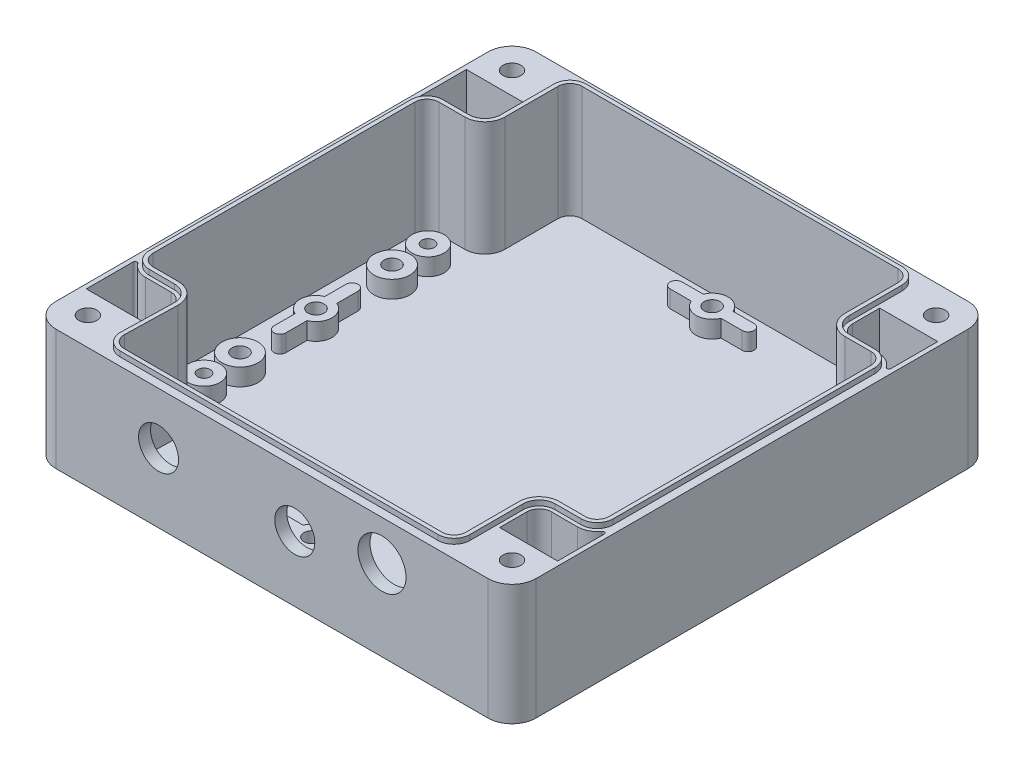
from build123d import *

# Parameters (mm, degrees)
SKETCH_1_R             = 2.25
EXTRUDE_1_DEPTH        = 31.5
CUT_EXTRUDE_1_DEPTH    = 28.65
CUT_EXTRUDE_START      = -1.3
CUT_EXTRUDE_2_DEPTH    = 1.3
SKETCH_4_R             = 4.5
SKETCH_4_R_2           = 2
SKETCH_4_R_3           = 4
EXTRUDE_5_DEPTH        = 4.3
HOLE_WIZARD_M3_1_D     = 3.15
HOLE_WIZARD_M3_1_DEPTH = 4
HOLE_WIZARD_M3_1_TIP   = 0.946355475
CUT_EXTRUDE_3_REACH    = 174.842
SKETCH_7_R             = 5
SKETCH_7_R_2           = 6


with BuildPart() as part:
    # 草圖1 → 填料-伸長1 (new body)
    with BuildSketch(Plane(origin=(0, 0, 0), x_dir=(1, 0, 0), z_dir=(0, 1, 0))):
        with BuildLine():
            Line((6.340909091, 120.340909091), (114.340909091, 120.340909091))
            ThreePointArc((114.340909091, 120.340909091), (118.583549778, 118.583549778), (120.340909091, 114.340909091))
            Line((120.340909091, 114.340909091), (120.340909091, 6.340909091))
            ThreePointArc((120.340909091, 6.340909091), (118.583549778, 2.098268404), (114.340909091, 0.340909091))
            Line((114.340909091, 0.340909091), (6.340909091, 0.340909091))
            ThreePointArc((6.340909091, 0.340909091), (2.098268404, 2.098268404), (0.340909091, 6.340909091))
            Line((0.340909091, 6.340909091), (0.340909091, 114.340909091))
            ThreePointArc((0.340909091, 114.340909091), (2.098268404, 118.583549778), (6.340909091, 120.340909091))
        make_face()
        with Locations(Location((7.340909091, 113.340909091, 0), (0, 0, 270))):
            Circle(SKETCH_1_R, mode=Mode.SUBTRACT)
        with Locations(Location((7.340909091, 103.340909091, 0), (0, 0, 270))):
            Circle(SKETCH_1_R, mode=Mode.SUBTRACT)
        with Locations(Location((113.340909091, 113.340909091, 0), (0, 0, 270))):
            Circle(SKETCH_1_R, mode=Mode.SUBTRACT)
        with Locations(Location((113.340909091, 103.340909091, 0), (0, 0, 270))):
            Circle(SKETCH_1_R, mode=Mode.SUBTRACT)
        with Locations(Location((7.340909091, 17.340909091, 0), (0, 0, 270))):
            Circle(SKETCH_1_R, mode=Mode.SUBTRACT)
        with Locations(Location((7.340909091, 7.340909091, 0), (0, 0, 270))):
            Circle(SKETCH_1_R, mode=Mode.SUBTRACT)
        with Locations(Location((113.340909091, 17.340909091, 0), (0, 0, 270))):
            Circle(SKETCH_1_R, mode=Mode.SUBTRACT)
        with Locations(Location((113.340909091, 7.340909091, 0), (0, 0, 270))):
            Circle(SKETCH_1_R, mode=Mode.SUBTRACT)
    extrude(amount=EXTRUDE_1_DEPTH)

    # 草圖2 → 除料-伸長1 (cut)
    with BuildSketch(Plane(origin=(0, 31.5, 0), x_dir=(1, 0, 0), z_dir=(0, 1, 0))):
        with BuildLine():
            Line((15.940908992, 101.053812481), (15.940908992, 107.840909091))
            Line((15.940908992, 107.840909091), (1.440909091, 107.840909091))
            Line((1.440909091, 107.840909091), (1.440909091, 96.184307649))
            ThreePointArc((1.440909091, 96.184307649), (1.788763936, 95.708017977), (2.348316498, 95.894446985))
            ThreePointArc((2.348316498, 95.894446985), (4.094702185, 97.408643653), (6.340909091, 97.953812481))
            Line((6.340909091, 97.953812481), (12.840908992, 97.953812481))
            ThreePointArc((12.840908992, 97.953812481), (15.032940014, 98.861781459), (15.940908992, 101.053812481))
        make_face()
        with BuildLine():
            Line((6.328095563, 22.75810538), (12.727920948, 22.741369743))
            ThreePointArc((12.727920948, 22.741369743), (14.940810853, 21.804058056), (15.818922369, 19.567016463))
            Line((15.818922369, 19.567016463), (15.65752772, 12.840909091))
            Line((15.65752772, 12.840909091), (1.440909091, 12.840909091))
            Line((1.440909091, 12.840909091), (1.440909091, 24.527593458))
            ThreePointArc((1.440909091, 24.527593458), (1.788763936, 25.00388313), (2.348316498, 24.817454121))
            ThreePointArc((2.348316498, 24.817454121), (4.089010146, 23.306198101), (6.328095563, 22.75810538))
        make_face()
        with BuildLine():
            Line((6.340909091, 96.053812481), (12.840908992, 96.053812481))
            ThreePointArc((12.840908992, 96.053812481), (16.376442898, 97.518278575), (17.840908992, 101.053812481))
            Line((17.840908992, 101.053812481), (17.840908992, 114.340909091))
            ThreePointArc((17.840908992, 114.340909091), (18.719588648, 116.462229434), (20.840908992, 117.340909091))
            Line((20.840908992, 117.340909091), (99.84090919, 117.340909091))
            ThreePointArc((99.84090919, 117.340909091), (101.962229533, 116.462229434), (102.84090919, 114.340909091))
            Line((102.84090919, 114.340909091), (102.84090919, 101.053812481))
            ThreePointArc((102.84090919, 101.053812481), (104.305375284, 97.518278575), (107.84090919, 96.053812481))
            Line((107.84090919, 96.053812481), (114.340909091, 96.053812481))
            ThreePointArc((114.340909091, 96.053812481), (116.462229434, 95.175132824), (117.340909091, 93.053812481))
            Line((117.340909091, 93.053812481), (117.340909091, 27.628005701))
            ThreePointArc((117.340909091, 27.628005701), (116.462229434, 25.506685358), (114.340909091, 24.628005701))
            Line((114.340909091, 24.628005701), (107.84090919, 24.628005701))
            ThreePointArc((107.84090919, 24.628005701), (104.305375284, 23.163539607), (102.84090919, 19.628005701))
            Line((102.84090919, 19.628005701), (102.84090919, 6.340909091))
            ThreePointArc((102.84090919, 6.340909091), (101.962229533, 4.219588747), (99.84090919, 3.340909091))
            Line((99.84090919, 3.340909091), (20.402969013, 3.340909091))
            ThreePointArc((20.402969013, 3.340909091), (18.256355968, 4.245186678), (17.403832299, 6.412874136))
            Line((17.403832299, 6.412874136), (17.718375622, 19.521438601))
            ThreePointArc((17.718375622, 19.521438601), (16.302066724, 23.129570204), (12.732889459, 24.641363247))
            Line((12.732889459, 24.641363247), (6.333064074, 24.658098883))
            ThreePointArc((6.333064074, 24.658098883), (4.216816926, 25.53954373), (3.340909091, 27.658088626))
            Line((3.340909091, 27.658088626), (3.340909091, 93.053812481))
            ThreePointArc((3.340909091, 93.053812481), (4.219588747, 95.175132824), (6.340909091, 96.053812481))
        make_face()
        with BuildLine():
            Line((104.74090919, 19.628005701), (104.74090919, 12.840909091))
            Line((104.74090919, 12.840909091), (119.240909091, 12.840909091))
            Line((119.240909091, 12.840909091), (119.240909091, 24.497510533))
            ThreePointArc((119.240909091, 24.497510533), (118.893054246, 24.973800205), (118.333501683, 24.787371196))
            ThreePointArc((118.333501683, 24.787371196), (116.587115997, 23.273174529), (114.340909091, 22.728005701))
            Line((114.340909091, 22.728005701), (107.84090919, 22.728005701))
            ThreePointArc((107.84090919, 22.728005701), (105.648878168, 21.820036723), (104.74090919, 19.628005701))
        make_face()
        with BuildLine():
            Line((114.340909091, 97.953812481), (107.84090919, 97.953812481))
            ThreePointArc((107.84090919, 97.953812481), (105.648878168, 98.861781459), (104.74090919, 101.053812481))
            Line((104.74090919, 101.053812481), (104.74090919, 107.840909091))
            Line((104.74090919, 107.840909091), (119.240909091, 107.840909091))
            Line((119.240909091, 107.840909091), (119.240909091, 96.184307649))
            ThreePointArc((119.240909091, 96.184307649), (118.893054246, 95.708017977), (118.333501683, 95.894446985))
            ThreePointArc((118.333501683, 95.894446985), (116.587115997, 97.408643653), (114.340909091, 97.953812481))
        make_face()
    extrude(amount=-CUT_EXTRUDE_1_DEPTH, mode=Mode.SUBTRACT)

    # 草圖3 → 除料-伸長2 (cut)
    with BuildSketch(Plane(origin=(0, 31.5, 0), x_dir=(1, 0, 0), z_dir=(0, 1, 0)).offset(CUT_EXTRUDE_START)):
        with BuildLine():
            Line((6.340909091, 0.340909091), (114.340909091, 0.340909091))
            ThreePointArc((114.340909091, 0.340909091), (118.583549778, 2.098268404), (120.340909091, 6.340909091))
            Line((120.340909091, 6.340909091), (120.340909091, 114.340909091))
            ThreePointArc((120.340909091, 114.340909091), (118.583549778, 118.583549778), (114.340909091, 120.340909091))
            Line((114.340909091, 120.340909091), (6.340909091, 120.340909091))
            ThreePointArc((6.340909091, 120.340909091), (2.098268404, 118.583549778), (0.340909091, 114.340909091))
            Line((0.340909091, 114.340909091), (0.340909091, 6.340909091))
            ThreePointArc((0.340909091, 6.340909091), (2.098268404, 2.098268404), (6.340909091, 0.340909091))
        make_face()
        with BuildLine():
            Line((103.84090919, 101.053812481), (103.84090919, 114.340909091))
            ThreePointArc((103.84090919, 114.340909091), (102.669336315, 117.169336216), (99.84090919, 118.340909091))
            Line((99.84090919, 118.340909091), (20.840908992, 118.340909091))
            ThreePointArc((20.840908992, 118.340909091), (18.012481867, 117.169336216), (16.840908992, 114.340909091))
            Line((16.840908992, 114.340909091), (16.840908992, 101.053812481))
            ThreePointArc((16.840908992, 101.053812481), (15.669336117, 98.225385356), (12.840908992, 97.053812481))
            Line((12.840908992, 97.053812481), (6.340909091, 97.053812481))
            ThreePointArc((6.340909091, 97.053812481), (3.512481966, 95.882239605), (2.340909091, 93.053812481))
            Line((2.340909091, 93.053812481), (2.340909091, 27.658088626))
            ThreePointArc((2.340909091, 27.658088626), (3.508786204, 24.833362099), (6.330449068, 23.658102303))
            Line((6.330449068, 23.658102303), (12.730274453, 23.641366666))
            ThreePointArc((12.730274453, 23.641366666), (15.585616265, 22.431932231), (16.718663383, 19.545426949))
            Line((16.718663383, 19.545426949), (16.40412006, 6.436862484))
            ThreePointArc((16.40412006, 6.436862484), (17.540818286, 3.54661254), (20.402969013, 2.340909091))
            Line((20.402969013, 2.340909091), (99.84090919, 2.340909091))
            ThreePointArc((99.84090919, 2.340909091), (102.669336315, 3.512481966), (103.84090919, 6.340909091))
            Line((103.84090919, 6.340909091), (103.84090919, 19.628005701))
            ThreePointArc((103.84090919, 19.628005701), (105.012482065, 22.456432826), (107.84090919, 23.628005701))
            Line((107.84090919, 23.628005701), (114.340909091, 23.628005701))
            ThreePointArc((114.340909091, 23.628005701), (117.169336216, 24.799578576), (118.340909091, 27.628005701))
            Line((118.340909091, 27.628005701), (118.340909091, 93.053812481))
            ThreePointArc((118.340909091, 93.053812481), (117.169336216, 95.882239605), (114.340909091, 97.053812481))
            Line((114.340909091, 97.053812481), (107.84090919, 97.053812481))
            ThreePointArc((107.84090919, 97.053812481), (105.012482065, 98.225385356), (103.84090919, 101.053812481))
        make_face(mode=Mode.SUBTRACT)
    extrude(amount=CUT_EXTRUDE_2_DEPTH, mode=Mode.SUBTRACT)

    # 草圖4 → 填料-伸長5 (add)
    # profile 1 of 12: a face of its own
    with BuildSketch(Plane(origin=(0, 2.85, 0), x_dir=(1, 0, 0), z_dir=(0, 1, 0))):
        with Locations(Location((11.340909091, 79.355950553, 0), (0, 0, 90))):
            Circle(SKETCH_4_R)
        with Locations(Location((11.340909091, 79.355950553, 0), (0, 0, 90))):
            Circle(SKETCH_4_R_2, mode=Mode.SUBTRACT)
    # profile 2 of 12: a face of its own
    with BuildSketch(Plane(origin=(0, 2.85, 0), x_dir=(1, 0, 0), z_dir=(0, 1, 0))):
        with Locations(Location((11.340909091, 88.355950553, 0), (0, 0, 90))):
            Circle(SKETCH_4_R_3)
    # profile 3 of 12: a face of its own
    with BuildSketch(Plane(origin=(0, 2.85, 0), x_dir=(1, 0, 0), z_dir=(0, 1, 0))):
        with Locations(Location((11.340909091, 41.355950553, 0), (0, 0, 90))):
            Circle(SKETCH_4_R)
        with Locations(Location((11.340909091, 41.355950553, 0), (0, 0, 90))):
            Circle(SKETCH_4_R_2, mode=Mode.SUBTRACT)
    # profile 4 of 12: a face of its own
    with BuildSketch(Plane(origin=(0, 2.85, 0), x_dir=(1, 0, 0), z_dir=(0, 1, 0))):
        with Locations(Location((11.340909091, 32.355950553, 0), (0, 0, 90))):
            Circle(SKETCH_4_R_3)
    # profile 5 of 12: a face of its own
    with BuildSketch(Plane(origin=(0, 2.85, 0), x_dir=(1, 0, 0), z_dir=(0, 1, 0))):
        with Locations(Location((109.340909091, 88.355950553, 0), (0, 0, 90))):
            Circle(SKETCH_4_R_3)
    # profile 6 of 12: a face of its own
    with BuildSketch(Plane(origin=(0, 2.85, 0), x_dir=(1, 0, 0), z_dir=(0, 1, 0))):
        with Locations(Location((109.340909091, 79.355950553, 0), (0, 0, 90))):
            Circle(SKETCH_4_R)
        with Locations(Location((109.340909091, 79.355950553, 0), (0, 0, 90))):
            Circle(SKETCH_4_R_2, mode=Mode.SUBTRACT)
    # profile 7 of 12: a face of its own
    with BuildSketch(Plane(origin=(0, 2.85, 0), x_dir=(1, 0, 0), z_dir=(0, 1, 0))):
        with Locations(Location((109.340909091, 41.355950553, 0), (0, 0, 90))):
            Circle(SKETCH_4_R)
        with Locations(Location((109.340909091, 41.355950553, 0), (0, 0, 90))):
            Circle(SKETCH_4_R_2, mode=Mode.SUBTRACT)
    # profile 8 of 12: a face of its own
    with BuildSketch(Plane(origin=(0, 2.85, 0), x_dir=(1, 0, 0), z_dir=(0, 1, 0))):
        with Locations(Location((109.340909091, 32.355950553, 0), (0, 0, 90))):
            Circle(SKETCH_4_R_3)
    # profile 9 of 12: a face of its own
    with BuildSketch(Plane(origin=(0, 2.85, 0), x_dir=(1, 0, 0), z_dir=(0, 1, 0))):
        with BuildLine():
            Line((64.049008334, 111.855950553), (69.340909091, 111.855950553))
            ThreePointArc((69.340909091, 111.855950553), (70.840909091, 110.355950553), (69.340909091, 108.855950553))
            Line((69.340909091, 108.855950553), (64.049008334, 108.855950553))
            ThreePointArc((64.049008334, 108.855950553), (60.340909091, 106.355950553), (56.632809847, 108.855950553))
            Line((56.632809847, 108.855950553), (51.340909091, 108.855950553))
            ThreePointArc((51.340909091, 108.855950553), (49.840909091, 110.355950553), (51.340909091, 111.855950553))
            Line((51.340909091, 111.855950553), (56.632809847, 111.855950553))
            ThreePointArc((56.632809847, 111.855950553), (60.340909091, 114.355950553), (64.049008334, 111.855950553))
        make_face()
        with Locations(Location((60.340909091, 110.355950553, 0), (0, 0, 90))):
            Circle(SKETCH_4_R_2, mode=Mode.SUBTRACT)
    # profile 10 of 12: a face of its own
    with BuildSketch(Plane(origin=(0, 2.85, 0), x_dir=(1, 0, 0), z_dir=(0, 1, 0))):
        with BuildLine():
            Line((107.840909091, 64.064049797), (107.840909091, 69.355950553))
            ThreePointArc((107.840909091, 69.355950553), (109.340909091, 70.855950553), (110.840909091, 69.355950553))
            Line((110.840909091, 69.355950553), (110.840909091, 64.064049797))
            ThreePointArc((110.840909091, 64.064049797), (113.340909091, 60.355950553), (110.840909091, 56.64785131))
            Line((110.840909091, 56.64785131), (110.840909091, 51.355950553))
            ThreePointArc((110.840909091, 51.355950553), (109.340909091, 49.855950553), (107.840909091, 51.355950553))
            Line((107.840909091, 51.355950553), (107.840909091, 56.64785131))
            ThreePointArc((107.840909091, 56.64785131), (105.340909091, 60.355950553), (107.840909091, 64.064049797))
        make_face()
        with Locations(Location((109.340909091, 60.355950553, 0), (0, 0, 90))):
            Circle(SKETCH_4_R_2, mode=Mode.SUBTRACT)
    # profile 11 of 12: a face of its own
    with BuildSketch(Plane(origin=(0, 2.85, 0), x_dir=(1, 0, 0), z_dir=(0, 1, 0))):
        with BuildLine():
            Line((51.340909091, 11.855950553), (56.632809847, 11.855950553))
            ThreePointArc((56.632809847, 11.855950553), (60.340909091, 14.355950553), (64.049008334, 11.855950553))
            Line((64.049008334, 11.855950553), (69.340909091, 11.855950553))
            ThreePointArc((69.340909091, 11.855950553), (70.840909091, 10.355950553), (69.340909091, 8.855950553))
            Line((69.340909091, 8.855950553), (64.049008334, 8.855950553))
            ThreePointArc((64.049008334, 8.855950553), (60.340909091, 6.355950553), (56.632809847, 8.855950553))
            Line((56.632809847, 8.855950553), (51.340909091, 8.855950553))
            ThreePointArc((51.340909091, 8.855950553), (49.840909091, 10.355950553), (51.340909091, 11.855950553))
        make_face()
        with Locations(Location((60.340909091, 10.355950553, 0), (0, 0, 90))):
            Circle(SKETCH_4_R_2, mode=Mode.SUBTRACT)
    # profile 12 of 12: a face of its own
    with BuildSketch(Plane(origin=(0, 2.85, 0), x_dir=(1, 0, 0), z_dir=(0, 1, 0))):
        with BuildLine():
            Line((9.840909091, 51.355950553), (9.840909091, 56.64785131))
            ThreePointArc((9.840909091, 56.64785131), (7.340909091, 60.355950553), (9.840909091, 64.064049797))
            Line((9.840909091, 64.064049797), (9.840909091, 69.355950553))
            ThreePointArc((9.840909091, 69.355950553), (11.340909091, 70.855950553), (12.840909091, 69.355950553))
            Line((12.840909091, 69.355950553), (12.840909091, 64.064049797))
            ThreePointArc((12.840909091, 64.064049797), (15.340909091, 60.355950553), (12.840909091, 56.64785131))
            Line((12.840909091, 56.64785131), (12.840909091, 51.355950553))
            ThreePointArc((12.840909091, 51.355950553), (11.340909091, 49.855950553), (9.840909091, 51.355950553))
        make_face()
        with Locations(Location((11.340909091, 60.355950553, 0), (0, 0, 90))):
            Circle(SKETCH_4_R_2, mode=Mode.SUBTRACT)
    extrude(amount=EXTRUDE_5_DEPTH)

    # M3 螺旋的螺孔鑽1
    with Locations(Plane(origin=(0, 7.15, 0), x_dir=(1, 0, 0), z_dir=(0, 1, 0))):
        with Locations((11.340909091, 88.355950553), (11.340909091, 32.355950553), (109.340909091, 32.355950553), (109.340909091, 88.355950553)):
            Hole(HOLE_WIZARD_M3_1_D / 2, depth=HOLE_WIZARD_M3_1_DEPTH)
            with Locations((0, 0, -(HOLE_WIZARD_M3_1_DEPTH + HOLE_WIZARD_M3_1_TIP / 2))):  # 118° drill point
                Cone(0, HOLE_WIZARD_M3_1_D / 2, HOLE_WIZARD_M3_1_TIP, mode=Mode.SUBTRACT)

    # 草圖7 → 除料-伸長3 (cut, up to next)
    with BuildSketch(Plane.XY.offset(-0.340909091), mode=Mode.PRIVATE) as cut_extrude_3_sk1:
        with Locations((32.002050768, 17.25)):
            Circle(SKETCH_7_R)
    cut_extrude_3_tool1 = extrude(cut_extrude_3_sk1.sketch, amount=-CUT_EXTRUDE_3_REACH, mode=Mode.PRIVATE) & part.part
    # 草圖7 → 除料-伸長3 (cut, up to next)
    with BuildSketch(Plane.XY.offset(-0.340909091), mode=Mode.PRIVATE) as cut_extrude_3_sk2:
        with Locations((66.052050768, 16.3)):
            Circle(SKETCH_7_R)
    cut_extrude_3_tool2 = extrude(cut_extrude_3_sk2.sketch, amount=-CUT_EXTRUDE_3_REACH, mode=Mode.PRIVATE) & part.part
    # 草圖7 → 除料-伸長3 (cut, up to next)
    with BuildSketch(Plane.XY.offset(-0.340909091), mode=Mode.PRIVATE) as cut_extrude_3_sk3:
        with Locations((87.84090919, 20.2)):
            Circle(SKETCH_7_R_2)
    cut_extrude_3_tool3 = extrude(cut_extrude_3_sk3.sketch, amount=-CUT_EXTRUDE_3_REACH, mode=Mode.PRIVATE) & part.part
    add(cut_extrude_3_tool1.solids().sort_by_distance((32.002051, 17.25, -0.340909))[0], mode=Mode.SUBTRACT)
    add(cut_extrude_3_tool2.solids().sort_by_distance((66.052051, 16.3, -0.340909))[0], mode=Mode.SUBTRACT)
    add(cut_extrude_3_tool3.solids().sort_by_distance((87.840909, 20.2, -0.340909))[0], mode=Mode.SUBTRACT)


solid = part.part
